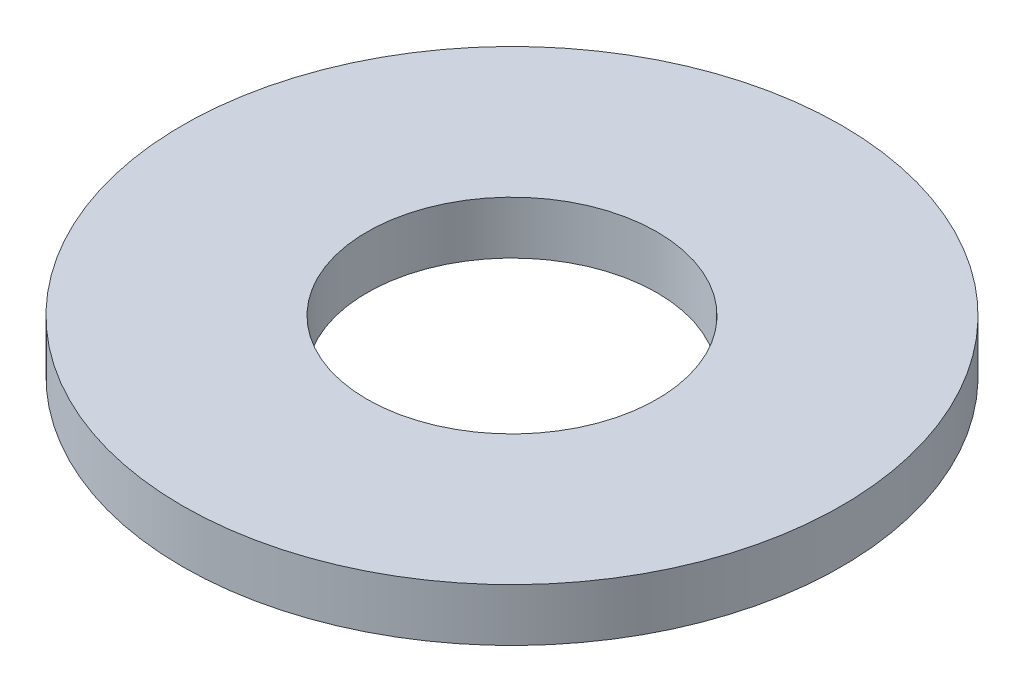
from build123d import *

# Parameters (mm, degrees)
SKETCH1_R           = 2.5
SKETCH1_R_2         = 1.1
BOSS_EXTRUDE1_DEPTH = 0.4


with BuildPart() as part:
    # Sketch1 → Boss-Extrude1 (new body)
    with BuildSketch(Plane(origin=(0, 0, 0), x_dir=(1, 0, 0), z_dir=(0, 1, 0))):
        with Locations(Location((-13.49029492, 17.546817169, 0), (0, 0, 270))):
            Circle(SKETCH1_R)
        with Locations(Location((-13.49029492, 17.546817169, 0), (0, 0, 270))):
            Circle(SKETCH1_R_2, mode=Mode.SUBTRACT)
    extrude(amount=BOSS_EXTRUDE1_DEPTH)


solid = part.part
